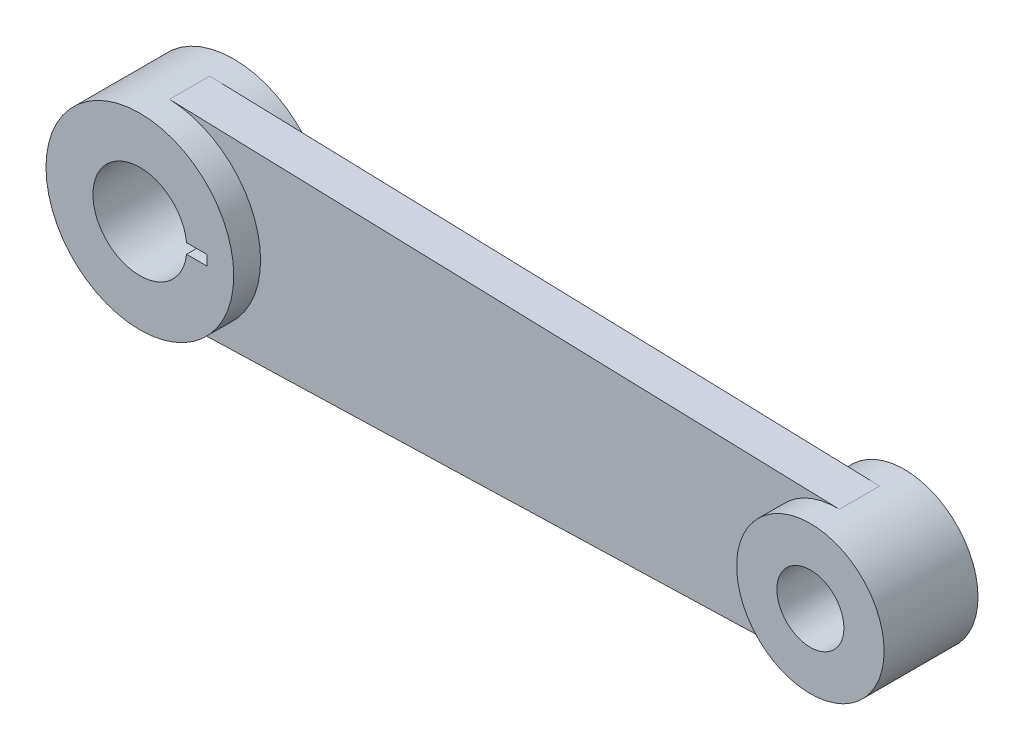
from build123d import *

# Parameters (mm, degrees)
EXTRUDE_1_DEPTH     = 6
SKETCH_3_R          = 14
SKETCH_3_R_2        = 11
EXTRUDE_3_DEPTH     = 7
SKETCH_4_R          = 5
CUT_EXTRUDE_1_DEPTH = 87.103712829


with BuildPart() as part:
    # 草图1 → 凸台-拉伸1 (new body)
    with BuildSketch(Plane.XY):
        with BuildLine():
            Line((-26.783524162, 13.993698582), (73.126475838, 10.995048886))
            ThreePointArc((73.126475838, 10.995048886), (83.796475838, 0), (73.126475838, -10.995048886))
            Line((73.126475838, -10.995048886), (-26.783524162, -13.993698582))
            ThreePointArc((-26.783524162, -13.993698582), (-41.203524162, 0), (-26.783524162, 13.993698582))
        make_face()
    extrude(amount=EXTRUDE_1_DEPTH)

    # 草图3 → 凸台-拉伸3 (add, symmetric)
    with BuildSketch(Plane.XY.offset(3)):
        with Locations((-27.203524162, 0)):
            Circle(SKETCH_3_R)
        with Locations((72.796475838, 0)):
            Circle(SKETCH_3_R_2)
    extrude(amount=EXTRUDE_3_DEPTH, both=True)

    # 草图4 → 切除-拉伸1 (cut, through all)
    with BuildSketch(Plane.XY.offset(10)):
        with Locations((72.796475838, 0)):
            Circle(SKETCH_4_R)
        with BuildLine():
            Line((-20.243818708, 0.75), (-17.203524162, 0.75))
            Line((-17.203524162, 0.75), (-17.203524162, -0.75))
            Line((-17.203524162, -0.75), (-20.243818708, -0.75))
            ThreePointArc((-20.243818708, -0.75), (-34.203524162, 0), (-20.243818708, 0.75))
        make_face()
    extrude(amount=-CUT_EXTRUDE_1_DEPTH, mode=Mode.SUBTRACT)


solid = part.part
